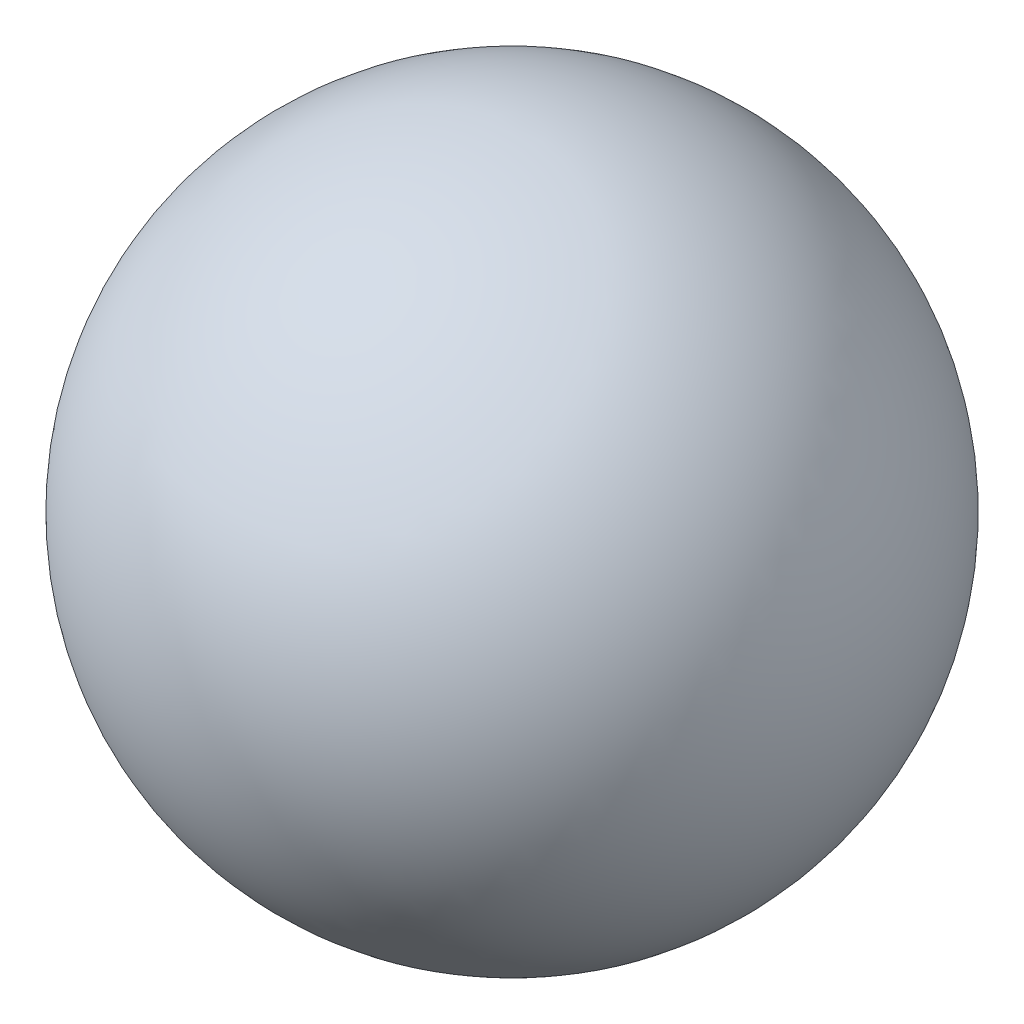
from build123d import *


with BuildPart() as part:
    # 草图1 → 旋转4 (revolve)
    with BuildSketch(Plane.XY):
        with BuildLine():
            Line((0, 21), (0, -21))
            ThreePointArc((0, -21), (-21, 0), (0, 21))
        make_face()
    revolve(axis=Axis((0, 21, 0), (0, -1, 0)))


solid = part.part
